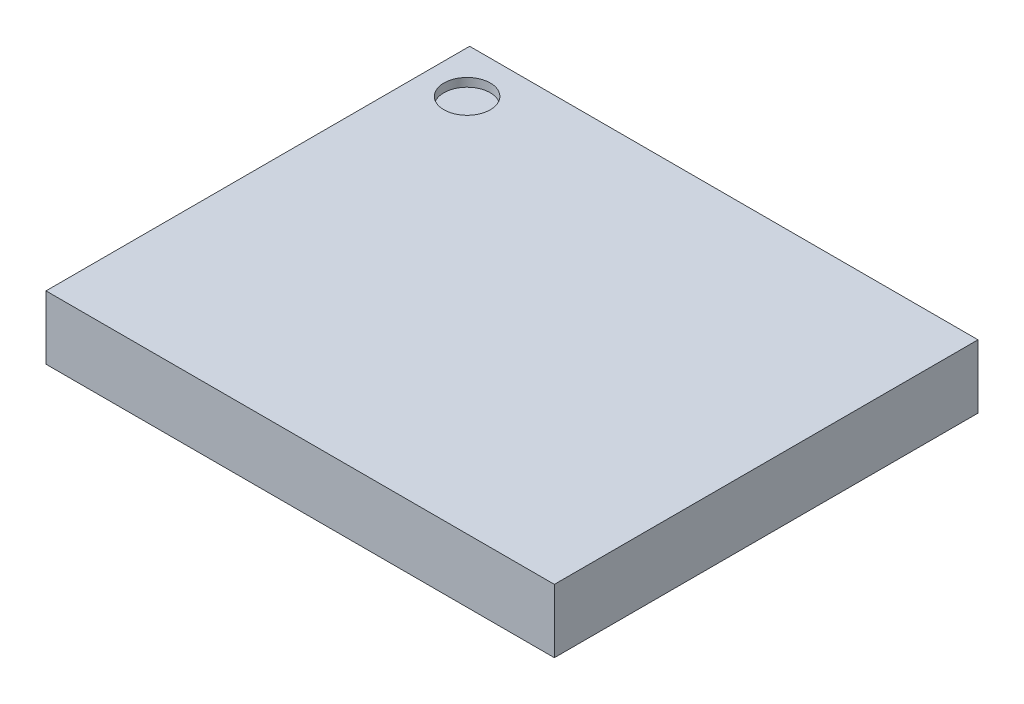
from build123d import *

# Parameters (mm, degrees)
SKETCH1_W           = 6
SKETCH1_H           = 5
BOSS_EXTRUDE1_DEPTH = 0.75
SKETCH2_R           = 0.27385381
CUT_EXTRUDE1_DEPTH  = 0.1


with BuildPart() as part:
    # Sketch1 → Boss-Extrude1 (new body)
    with BuildSketch(Plane(origin=(0, 0, 0), x_dir=(1, 0, 0), z_dir=(0, 1, 0))):
        Rectangle(SKETCH1_W, SKETCH1_H)
    extrude(amount=BOSS_EXTRUDE1_DEPTH)

    # Sketch2 → Cut-Extrude1 (cut)
    with BuildSketch(Plane(origin=(0, 0.75, 0), x_dir=(1, 0, 0), z_dir=(0, 1, 0))):
        with Locations(Location((-2.502889267, 1.972852669, 0), (0, 0, 270))):
            Circle(SKETCH2_R)
    extrude(amount=-CUT_EXTRUDE1_DEPTH, mode=Mode.SUBTRACT)


solid = part.part
